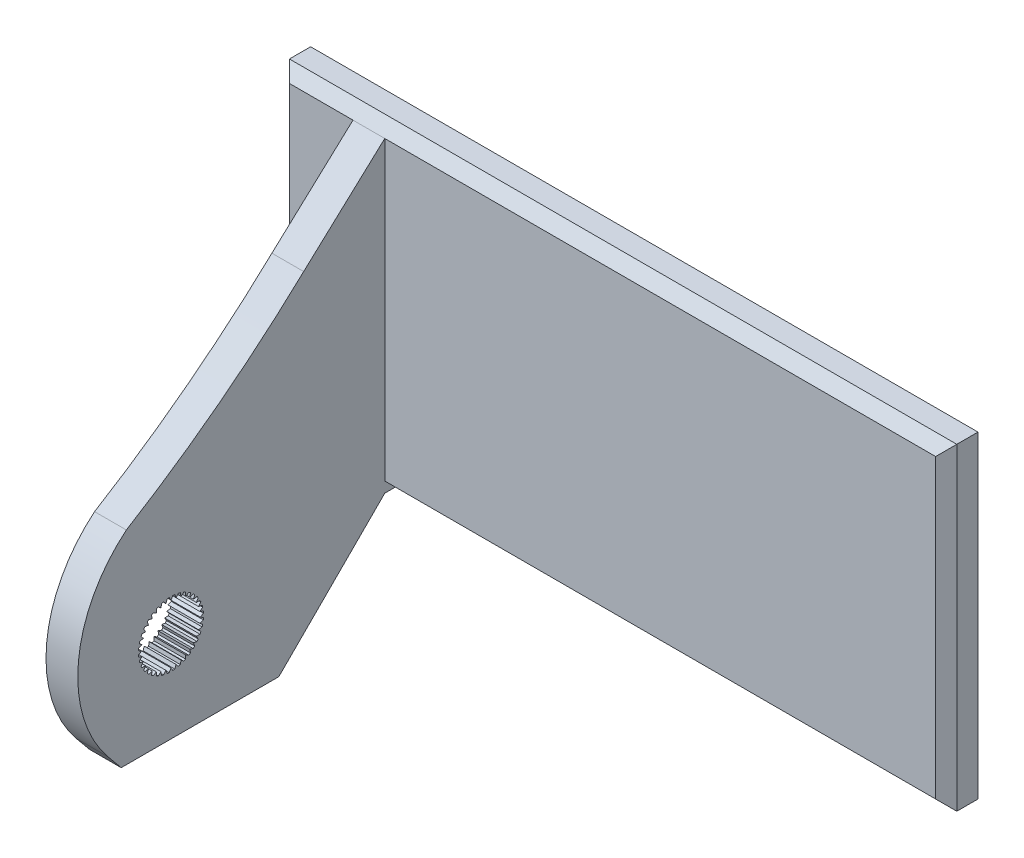
from build123d import *

# Parameters (mm, degrees)
SKETCH2_W           = 63
SKETCH2_H           = 30
BOSS_EXTRUDE2_DEPTH = 3
SKETCH6_W           = 3
SKETCH6_H           = 30
BOSS_EXTRUDE5_DEPTH = 20
SKETCH7_W           = 3
SKETCH7_H           = 23
BOSS_EXTRUDE6_DEPTH = 10
SKETCH8_W           = 3
SKETCH8_H           = 40
BOSS_EXTRUDE7_DEPTH = 15
CUT_EXTRUDE2_DEPTH  = 15
CUT_EXTRUDE3_DEPTH  = 15
CHAMFER2_SIZE       = 1
CUT_EXTRUDE4_DEPTH  = 15


with BuildPart() as part:
    # Sketch2 → Boss-Extrude2 (new body)
    with BuildSketch(Plane.XY):
        Rectangle(SKETCH2_W, SKETCH2_H)
    extrude(amount=BOSS_EXTRUDE2_DEPTH)

    # Sketch6 → Boss-Extrude5 (add)
    with BuildSketch(Plane.XY.offset(3)):
        with Locations((-23, 0)):
            Rectangle(SKETCH6_W, SKETCH6_H)
    extrude(amount=BOSS_EXTRUDE5_DEPTH)

    # Sketch7 → Boss-Extrude6 (add)
    with BuildSketch(Plane.XZ.offset(15)):
        with Locations((-23, 11.5)):
            Rectangle(SKETCH7_W, SKETCH7_H)
    extrude(amount=BOSS_EXTRUDE6_DEPTH)

    # Sketch8 → Boss-Extrude7 (add)
    with BuildSketch(Plane.XY.offset(23)):
        with Locations((-23, -5)):
            Rectangle(SKETCH8_W, SKETCH8_H)
    extrude(amount=BOSS_EXTRUDE7_DEPTH)

    # Sketch9 → Cut-Extrude2 (cut)
    with BuildSketch(Plane.ZY.offset(24.5)):
        with BuildLine():
            Line((25.637593138, -14.932048065), (25.683905045, -14.851833488))
            Line((25.683905045, -14.851833488), (25.747581591, -14.741542475))
            ThreePointArc((25.747581591, -14.741542475), (25.693941647, -14.662338413), (25.637860115, -14.584843968))
            Line((25.637860115, -14.584843968), (25.512441803, -14.606958601))
            Line((25.512441803, -14.606958601), (25.421225152, -14.623042557))
            Line((25.421225152, -14.623042557), (25.298780115, -14.644632921))
            Line((25.298780115, -14.644632921), (25.34130483, -14.527797226))
            Line((25.34130483, -14.527797226), (25.372984041, -14.440759311))
            Line((25.372984041, -14.440759311), (25.416541363, -14.32108655))
            ThreePointArc((25.416541363, -14.32108655), (25.349962689, -14.252400254), (25.281276393, -14.18582158))
            Line((25.281276393, -14.18582158), (25.161603633, -14.229378903))
            Line((25.161603633, -14.229378903), (25.074565717, -14.261058113))
            Line((25.074565717, -14.261058113), (24.957730022, -14.303582829))
            Line((24.957730022, -14.303582829), (24.979320386, -14.181137791))
            Line((24.979320386, -14.181137791), (24.995404343, -14.08992114))
            Line((24.995404343, -14.08992114), (25.017518975, -13.964502828))
            ThreePointArc((25.017518975, -13.964502828), (24.940024531, -13.908421297), (24.860820468, -13.854781352))
            Line((24.860820468, -13.854781352), (24.750529456, -13.918457898))
            Line((24.750529456, -13.918457898), (24.670314879, -13.964769806))
            Line((24.670314879, -13.964769806), (24.56263852, -14.02693678))
            Line((24.56263852, -14.02693678), (24.56263852, -13.902602831))
            Line((24.56263852, -13.902602831), (24.56263852, -13.809979016))
            Line((24.56263852, -13.809979016), (24.56263852, -13.682625924))
            ThreePointArc((24.56263852, -13.682625924), (24.476582935, -13.640853166), (24.389267681, -13.601781774))
            Line((24.389267681, -13.601781774), (24.291709553, -13.683642764))
            Line((24.291709553, -13.683642764), (24.220755594, -13.743180204))
            Line((24.220755594, -13.743180204), (24.125510263, -13.823100527))
            Line((24.125510263, -13.823100527), (24.1039199, -13.700655489))
            Line((24.1039199, -13.700655489), (24.087835943, -13.609438838))
            Line((24.087835943, -13.609438838), (24.065721311, -13.484020526))
            ThreePointArc((24.065721311, -13.484020526), (23.973719339, -13.457825786), (23.880945925, -13.434510111))
            Line((23.880945925, -13.434510111), (23.799084936, -13.532068239))
            Line((23.799084936, -13.532068239), (23.739547495, -13.603022198))
            Line((23.739547495, -13.603022198), (23.659627173, -13.698267529))
            Line((23.659627173, -13.698267529), (23.617102458, -13.581431834))
            Line((23.617102458, -13.581431834), (23.585423247, -13.494393919))
            Line((23.585423247, -13.494393919), (23.541865925, -13.374721158))
            ThreePointArc((23.541865925, -13.374721158), (23.446713001, -13.364900349), (23.351300299, -13.358048826))
            Line((23.351300299, -13.358048826), (23.287623753, -13.468339839))
            Line((23.287623753, -13.468339839), (23.241311846, -13.548554415))
            Line((23.241311846, -13.548554415), (23.179144871, -13.656230774))
            Line((23.179144871, -13.656230774), (23.116977896, -13.548554415))
            Line((23.116977896, -13.548554415), (23.070665989, -13.468339839))
            Line((23.070665989, -13.468339839), (23.006989443, -13.358048826))
            ThreePointArc((23.006989443, -13.358048826), (22.911576741, -13.364900349), (22.816423817, -13.374721158))
            Line((22.816423817, -13.374721158), (22.772866495, -13.494393919))
            Line((22.772866495, -13.494393919), (22.741187284, -13.581431834))
            Line((22.741187284, -13.581431834), (22.698662569, -13.698267529))
            Line((22.698662569, -13.698267529), (22.618742247, -13.603022198))
            Line((22.618742247, -13.603022198), (22.559204806, -13.532068239))
            Line((22.559204806, -13.532068239), (22.477343817, -13.434510111))
            ThreePointArc((22.477343817, -13.434510111), (22.384570403, -13.457825786), (22.292568431, -13.484020526))
            Line((22.292568431, -13.484020526), (22.270453799, -13.609438838))
            Line((22.270453799, -13.609438838), (22.254369843, -13.700655489))
            Line((22.254369843, -13.700655489), (22.232779479, -13.823100527))
            Line((22.232779479, -13.823100527), (22.137534148, -13.743180204))
            Line((22.137534148, -13.743180204), (22.066580189, -13.683642764))
            Line((22.066580189, -13.683642764), (21.969022061, -13.601781774))
            ThreePointArc((21.969022061, -13.601781774), (21.881706807, -13.640853166), (21.795651222, -13.682625924))
            Line((21.795651222, -13.682625924), (21.795651222, -13.809979016))
            Line((21.795651222, -13.809979016), (21.795651222, -13.902602831))
            Line((21.795651222, -13.902602831), (21.795651222, -14.02693678))
            Line((21.795651222, -14.02693678), (21.687974863, -13.964769806))
            Line((21.687974863, -13.964769806), (21.607760286, -13.918457898))
            Line((21.607760286, -13.918457898), (21.497469274, -13.854781352))
            ThreePointArc((21.497469274, -13.854781352), (21.418265211, -13.908421297), (21.340770767, -13.964502828))
            Line((21.340770767, -13.964502828), (21.362885399, -14.08992114))
            Line((21.362885399, -14.08992114), (21.378969356, -14.181137791))
            Line((21.378969356, -14.181137791), (21.40055972, -14.303582829))
            Line((21.40055972, -14.303582829), (21.283724025, -14.261058113))
            Line((21.283724025, -14.261058113), (21.196686109, -14.229378903))
            Line((21.196686109, -14.229378903), (21.077013349, -14.18582158))
            ThreePointArc((21.077013349, -14.18582158), (21.008327053, -14.252400254), (20.941748379, -14.32108655))
            Line((20.941748379, -14.32108655), (20.985305701, -14.440759311))
            Line((20.985305701, -14.440759311), (21.016984912, -14.527797226))
            Line((21.016984912, -14.527797226), (21.059509627, -14.644632921))
            Line((21.059509627, -14.644632921), (20.93706459, -14.623042557))
            Line((20.93706459, -14.623042557), (20.845847939, -14.606958601))
            Line((20.845847939, -14.606958601), (20.720429627, -14.584843968))
            ThreePointArc((20.720429627, -14.584843968), (20.664348095, -14.662338413), (20.610708151, -14.741542475))
            Line((20.610708151, -14.741542475), (20.674384697, -14.851833488))
            Line((20.674384697, -14.851833488), (20.720696604, -14.932048065))
            Line((20.720696604, -14.932048065), (20.782863579, -15.039724423))
            Line((20.782863579, -15.039724423), (20.658529629, -15.039724423))
            Line((20.658529629, -15.039724423), (20.565905815, -15.039724423))
            Line((20.565905815, -15.039724423), (20.438552723, -15.039724423))
            ThreePointArc((20.438552723, -15.039724423), (20.396779965, -15.125780009), (20.357708573, -15.213095262))
            Line((20.357708573, -15.213095262), (20.439569562, -15.31065339))
            Line((20.439569562, -15.31065339), (20.499107003, -15.381607349))
            Line((20.499107003, -15.381607349), (20.579027325, -15.47685268))
            Line((20.579027325, -15.47685268), (20.456582288, -15.498443044))
            Line((20.456582288, -15.498443044), (20.365365637, -15.514527001))
            Line((20.365365637, -15.514527001), (20.239947325, -15.536641633))
            ThreePointArc((20.239947325, -15.536641633), (20.213752584, -15.628643604), (20.190436909, -15.721417018))
            Line((20.190436909, -15.721417018), (20.287995038, -15.803278008))
            Line((20.287995038, -15.803278008), (20.358948996, -15.862815448))
            Line((20.358948996, -15.862815448), (20.454194327, -15.942735771))
            Line((20.454194327, -15.942735771), (20.337358632, -15.985260486))
            Line((20.337358632, -15.985260486), (20.250320717, -16.016939696))
            Line((20.250320717, -16.016939696), (20.130647957, -16.060497019))
            ThreePointArc((20.130647957, -16.060497019), (20.120827148, -16.155649942), (20.113975625, -16.251062644))
            Line((20.113975625, -16.251062644), (20.224266637, -16.31473919))
            Line((20.224266637, -16.31473919), (20.304481214, -16.361051098))
            Line((20.304481214, -16.361051098), (20.412157573, -16.423218073))
            Line((20.412157573, -16.423218073), (20.304481214, -16.485385047))
            Line((20.304481214, -16.485385047), (20.224266637, -16.531696955))
            Line((20.224266637, -16.531696955), (20.113975625, -16.595373501))
            ThreePointArc((20.113975625, -16.595373501), (20.120827148, -16.690786203), (20.130647957, -16.785939126))
            Line((20.130647957, -16.785939126), (20.250320717, -16.829496449))
            Line((20.250320717, -16.829496449), (20.337358632, -16.861175659))
            Line((20.337358632, -16.861175659), (20.454194327, -16.903700374))
            Line((20.454194327, -16.903700374), (20.358948996, -16.983620697))
            Line((20.358948996, -16.983620697), (20.287995038, -17.043158137))
            Line((20.287995038, -17.043158137), (20.190436909, -17.125019127))
            ThreePointArc((20.190436909, -17.125019127), (20.213752584, -17.217792541), (20.239947325, -17.309794512))
            Line((20.239947325, -17.309794512), (20.365365637, -17.331909144))
            Line((20.365365637, -17.331909144), (20.456582288, -17.347993101))
            Line((20.456582288, -17.347993101), (20.579027325, -17.369583465))
            Line((20.579027325, -17.369583465), (20.499107003, -17.464828796))
            Line((20.499107003, -17.464828796), (20.439569562, -17.535782755))
            Line((20.439569562, -17.535782755), (20.357708573, -17.633340883))
            ThreePointArc((20.357708573, -17.633340883), (20.396779965, -17.720656136), (20.438552723, -17.806711722))
            Line((20.438552723, -17.806711722), (20.565905815, -17.806711722))
            Line((20.565905815, -17.806711722), (20.658529629, -17.806711722))
            Line((20.658529629, -17.806711722), (20.782863579, -17.806711722))
            Line((20.782863579, -17.806711722), (20.720696604, -17.91438808))
            Line((20.720696604, -17.91438808), (20.674384697, -17.994602657))
            Line((20.674384697, -17.994602657), (20.610708151, -18.10489367))
            ThreePointArc((20.610708151, -18.10489367), (20.664348095, -18.184097732), (20.720429627, -18.261592177))
            Line((20.720429627, -18.261592177), (20.845847939, -18.239477544))
            Line((20.845847939, -18.239477544), (20.93706459, -18.223393588))
            Line((20.93706459, -18.223393588), (21.059509627, -18.201803224))
            Line((21.059509627, -18.201803224), (21.016984912, -18.318638919))
            Line((21.016984912, -18.318638919), (20.985305701, -18.405676834))
            Line((20.985305701, -18.405676834), (20.941748379, -18.525349595))
            ThreePointArc((20.941748379, -18.525349595), (21.008327053, -18.594035891), (21.077013349, -18.660614565))
            Line((21.077013349, -18.660614565), (21.196686109, -18.617057242))
            Line((21.196686109, -18.617057242), (21.283724025, -18.585378032))
            Line((21.283724025, -18.585378032), (21.40055972, -18.542853316))
            Line((21.40055972, -18.542853316), (21.378969356, -18.665298354))
            Line((21.378969356, -18.665298354), (21.362885399, -18.756515005))
            Line((21.362885399, -18.756515005), (21.340770767, -18.881933317))
            ThreePointArc((21.340770767, -18.881933317), (21.418265211, -18.938014848), (21.497469274, -18.991654793))
            Line((21.497469274, -18.991654793), (21.607760286, -18.927978247))
            Line((21.607760286, -18.927978247), (21.687974863, -18.881666339))
            Line((21.687974863, -18.881666339), (21.795651222, -18.819499365))
            Line((21.795651222, -18.819499365), (21.795651222, -18.943833314))
            Line((21.795651222, -18.943833314), (21.795651222, -19.036457129))
            Line((21.795651222, -19.036457129), (21.795651222, -19.163810221))
            ThreePointArc((21.795651222, -19.163810221), (21.881706807, -19.205582979), (21.969022061, -19.244654371))
            Line((21.969022061, -19.244654371), (22.066580189, -19.162793381))
            Line((22.066580189, -19.162793381), (22.137534148, -19.103255941))
            Line((22.137534148, -19.103255941), (22.232779479, -19.023335618))
            Line((22.232779479, -19.023335618), (22.254369843, -19.145780656))
            Line((22.254369843, -19.145780656), (22.270453799, -19.236997307))
            Line((22.270453799, -19.236997307), (22.292568431, -19.362415619))
            ThreePointArc((22.292568431, -19.362415619), (22.384570403, -19.388610359), (22.477343817, -19.411926034))
            Line((22.477343817, -19.411926034), (22.559204806, -19.314367906))
            Line((22.559204806, -19.314367906), (22.618742247, -19.243413947))
            Line((22.618742247, -19.243413947), (22.698662569, -19.148168616))
            Line((22.698662569, -19.148168616), (22.741187284, -19.265004311))
            Line((22.741187284, -19.265004311), (22.772866495, -19.352042226))
            Line((22.772866495, -19.352042226), (22.816423817, -19.471714987))
            ThreePointArc((22.816423817, -19.471714987), (22.911576741, -19.481535796), (23.006989443, -19.488387319))
            Line((23.006989443, -19.488387319), (23.070665989, -19.378096306))
            Line((23.070665989, -19.378096306), (23.116977896, -19.29788173))
            Line((23.116977896, -19.29788173), (23.179144871, -19.190205371))
            Line((23.179144871, -19.190205371), (23.241311846, -19.29788173))
            Line((23.241311846, -19.29788173), (23.287623753, -19.378096306))
            Line((23.287623753, -19.378096306), (23.351300299, -19.488387319))
            ThreePointArc((23.351300299, -19.488387319), (23.446713001, -19.481535796), (23.541865925, -19.471714987))
            Line((23.541865925, -19.471714987), (23.585423247, -19.352042226))
            Line((23.585423247, -19.352042226), (23.617102458, -19.265004311))
            Line((23.617102458, -19.265004311), (23.659627173, -19.148168616))
            Line((23.659627173, -19.148168616), (23.739547495, -19.243413947))
            Line((23.739547495, -19.243413947), (23.799084936, -19.314367906))
            Line((23.799084936, -19.314367906), (23.880945925, -19.411926034))
            ThreePointArc((23.880945925, -19.411926034), (23.973719339, -19.388610359), (24.065721311, -19.362415619))
            Line((24.065721311, -19.362415619), (24.087835943, -19.236997307))
            Line((24.087835943, -19.236997307), (24.1039199, -19.145780656))
            Line((24.1039199, -19.145780656), (24.125510263, -19.023335618))
            Line((24.125510263, -19.023335618), (24.220755594, -19.103255941))
            Line((24.220755594, -19.103255941), (24.291709553, -19.162793381))
            Line((24.291709553, -19.162793381), (24.389267681, -19.244654371))
            ThreePointArc((24.389267681, -19.244654371), (24.476582935, -19.205582979), (24.56263852, -19.163810221))
            Line((24.56263852, -19.163810221), (24.56263852, -19.036457129))
            Line((24.56263852, -19.036457129), (24.56263852, -18.943833314))
            Line((24.56263852, -18.943833314), (24.56263852, -18.819499365))
            Line((24.56263852, -18.819499365), (24.670314879, -18.881666339))
            Line((24.670314879, -18.881666339), (24.750529456, -18.927978247))
            Line((24.750529456, -18.927978247), (24.860820468, -18.991654793))
            ThreePointArc((24.860820468, -18.991654793), (24.940024531, -18.938014848), (25.017518975, -18.881933317))
            Line((25.017518975, -18.881933317), (24.995404343, -18.756515005))
            Line((24.995404343, -18.756515005), (24.979320386, -18.665298354))
            Line((24.979320386, -18.665298354), (24.957730022, -18.542853316))
            Line((24.957730022, -18.542853316), (25.074565717, -18.585378032))
            Line((25.074565717, -18.585378032), (25.161603633, -18.617057242))
            Line((25.161603633, -18.617057242), (25.281276393, -18.660614565))
            ThreePointArc((25.281276393, -18.660614565), (25.349962689, -18.594035891), (25.416541363, -18.525349595))
            Line((25.416541363, -18.525349595), (25.372984041, -18.405676834))
            Line((25.372984041, -18.405676834), (25.34130483, -18.318638919))
            Line((25.34130483, -18.318638919), (25.298780115, -18.201803224))
            Line((25.298780115, -18.201803224), (25.421225152, -18.223393588))
            Line((25.421225152, -18.223393588), (25.512441803, -18.239477544))
            Line((25.512441803, -18.239477544), (25.637860115, -18.261592177))
            ThreePointArc((25.637860115, -18.261592177), (25.693941647, -18.184097732), (25.747581591, -18.10489367))
            Line((25.747581591, -18.10489367), (25.683905045, -17.994602657))
            Line((25.683905045, -17.994602657), (25.637593138, -17.91438808))
            Line((25.637593138, -17.91438808), (25.575426163, -17.806711722))
            Line((25.575426163, -17.806711722), (25.699760113, -17.806711722))
            Line((25.699760113, -17.806711722), (25.792383928, -17.806711722))
            Line((25.792383928, -17.806711722), (25.919737019, -17.806711722))
            ThreePointArc((25.919737019, -17.806711722), (25.961509777, -17.720656136), (26.000581169, -17.633340883))
            Line((26.000581169, -17.633340883), (25.91872018, -17.535782755))
            Line((25.91872018, -17.535782755), (25.859182739, -17.464828796))
            Line((25.859182739, -17.464828796), (25.779262417, -17.369583465))
            Line((25.779262417, -17.369583465), (25.901707454, -17.347993101))
            Line((25.901707454, -17.347993101), (25.992924105, -17.331909144))
            Line((25.992924105, -17.331909144), (26.118342417, -17.309794512))
            ThreePointArc((26.118342417, -17.309794512), (26.144537158, -17.217792541), (26.167852833, -17.125019127))
            Line((26.167852833, -17.125019127), (26.070294704, -17.043158137))
            Line((26.070294704, -17.043158137), (25.999340746, -16.983620697))
            Line((25.999340746, -16.983620697), (25.904095415, -16.903700374))
            Line((25.904095415, -16.903700374), (26.02093111, -16.861175659))
            Line((26.02093111, -16.861175659), (26.107969025, -16.829496449))
            Line((26.107969025, -16.829496449), (26.227641785, -16.785939126))
            ThreePointArc((26.227641785, -16.785939126), (26.237462594, -16.690786203), (26.244314117, -16.595373501))
            Line((26.244314117, -16.595373501), (26.134023105, -16.531696955))
            Line((26.134023105, -16.531696955), (26.053808528, -16.485385047))
            Line((26.053808528, -16.485385047), (25.946132169, -16.423218073))
            Line((25.946132169, -16.423218073), (26.053808528, -16.361051098))
            Line((26.053808528, -16.361051098), (26.134023105, -16.31473919))
            Line((26.134023105, -16.31473919), (26.244314117, -16.251062644))
            ThreePointArc((26.244314117, -16.251062644), (26.237462594, -16.155649942), (26.227641785, -16.060497019))
            Line((26.227641785, -16.060497019), (26.107969025, -16.016939696))
            Line((26.107969025, -16.016939696), (26.02093111, -15.985260486))
            Line((26.02093111, -15.985260486), (25.904095415, -15.942735771))
            Line((25.904095415, -15.942735771), (25.999340746, -15.862815448))
            Line((25.999340746, -15.862815448), (26.070294704, -15.803278008))
            Line((26.070294704, -15.803278008), (26.167852833, -15.721417018))
            ThreePointArc((26.167852833, -15.721417018), (26.144537158, -15.628643604), (26.118342417, -15.536641633))
            Line((26.118342417, -15.536641633), (25.992924105, -15.514527001))
            Line((25.992924105, -15.514527001), (25.901707454, -15.498443044))
            Line((25.901707454, -15.498443044), (25.779262417, -15.47685268))
            Line((25.779262417, -15.47685268), (25.859182739, -15.381607349))
            Line((25.859182739, -15.381607349), (25.91872018, -15.31065339))
            Line((25.91872018, -15.31065339), (26.000581169, -15.213095262))
            ThreePointArc((26.000581169, -15.213095262), (25.961509777, -15.125780009), (25.919737019, -15.039724423))
            Line((25.919737019, -15.039724423), (25.792383928, -15.039724423))
            Line((25.792383928, -15.039724423), (25.699760113, -15.039724423))
            Line((25.699760113, -15.039724423), (25.575426163, -15.039724423))
            Line((25.575426163, -15.039724423), (25.637593138, -14.932048065))
        make_face()
    extrude(amount=-CUT_EXTRUDE2_DEPTH, mode=Mode.SUBTRACT)

    # Sketch10 → Cut-Extrude3 (cut)
    with BuildSketch(Plane.ZY.offset(24.5)):
        with BuildLine():
            ThreePointArc((27.392981546, -5.808626129), (31.91865842, -14.28970274), (29.121768443, -23.48686633))
            Line((29.121768443, -23.48686633), (27.878216059, -25))
            Line((27.878216059, -25), (38, -25))
            Line((38, -25), (38, 15))
            Line((38, 15), (3, 15))
            ThreePointArc((3, 15), (14.365462469, 3.621511227), (27.392981546, -5.808626129))
        make_face()
        Polygon((0, -25), (13, -25), (3, -15), (0, -15), align=None)
    extrude(amount=-CUT_EXTRUDE3_DEPTH, mode=Mode.SUBTRACT)

    # Chamfer2
    chamfer2_edges = [part.edges().sort_by_distance(p)[0] for p in [
        (31.5, 0, 3),
        (5, -15, 3),
        (-28, 15, 3),
        (5, 15, 3),
        (-31.5, 0, 3),
        (-28, -15, 3),
    ]]
    chamfer(chamfer2_edges, length=CHAMFER2_SIZE)

    # Sketch11 → Cut-Extrude4 (cut)
    with BuildSketch(Plane.ZY.offset(24.5)):
        Polygon((2, 15), (3, 14), (12.323915854, 5.411029954), (3, 15), align=None)
    extrude(amount=-CUT_EXTRUDE4_DEPTH, mode=Mode.SUBTRACT)


solid = part.part
